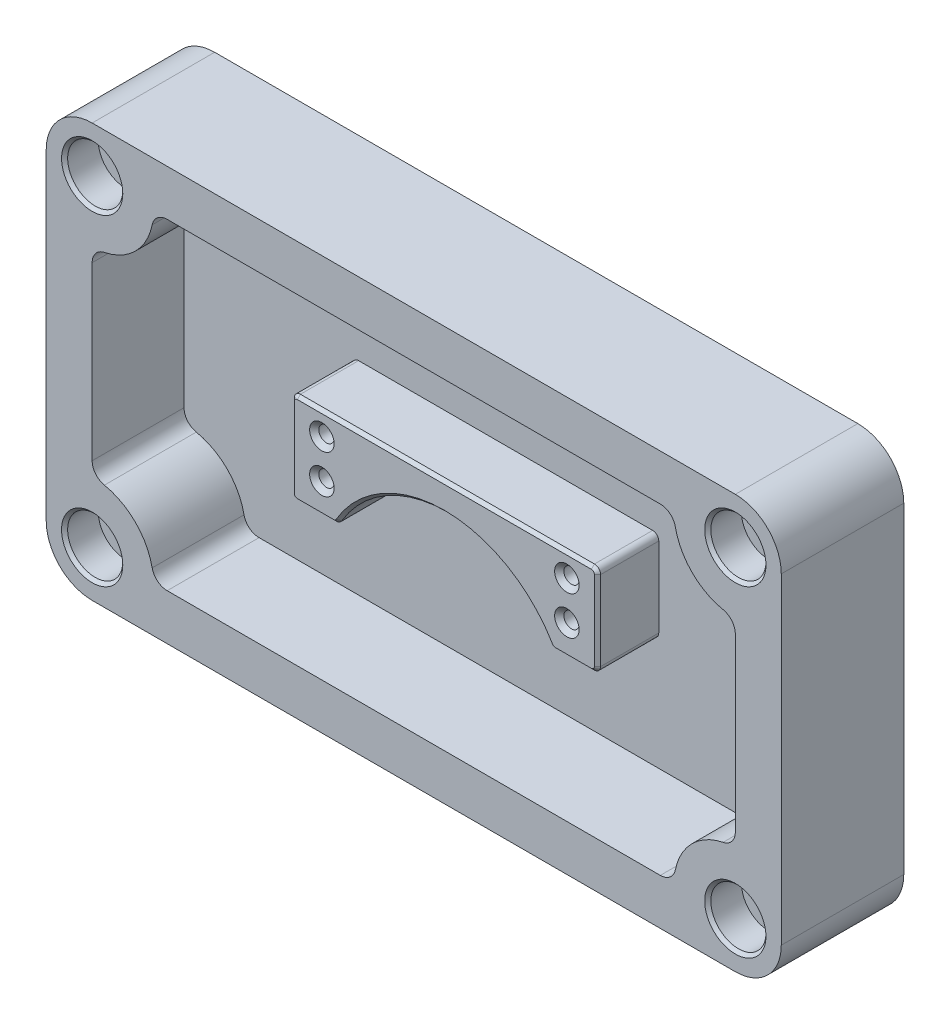
from build123d import *

# Parameters (mm, degrees)
SKETCH_1_R                   = 5.5
EXTRUDE_1_DEPTH              = 40
EXTRUDE_2_DEPTH              = 10
EXTRUDE_3_DEPTH              = 20
HOLE_WIZARD_M6_3_D           = 5
HOLE_WIZARD_M6_3_DEPTH       = 15
HOLE_WIZARD_M6_3_CSINK_D     = 8
HOLE_WIZARD_M6_3_CSINK_ANGLE = 90
HOLE_WIZARD_M6_3_TIP         = 1.502151548
SKETCH_9_R                   = 9
CUT_EXTRUDE_1_DEPTH          = 11
CHAMFER_2_SIZE               = 1
CHAMFER_3_SIZE               = 1


with BuildPart() as part:
    # 草图1 → 凸台-拉伸1 (new body)
    with BuildSketch(Plane.XY):
        with BuildLine():
            Line((0, 15), (0, 120))
            ThreePointArc((0, 120), (4.393398282, 130.606601718), (15, 135))
            Line((15, 135), (225, 135))
            ThreePointArc((225, 135), (235.606601718, 130.606601718), (240, 120))
            Line((240, 120), (240, 15))
            ThreePointArc((240, 15), (235.606601718, 4.393398282), (225, 0))
            Line((225, 0), (15, 0))
            ThreePointArc((15, 0), (4.393398282, 4.393398282), (0, 15))
        make_face()
        with Locations((225, 120)):
            Circle(SKETCH_1_R, mode=Mode.SUBTRACT)
        with Locations(Location((225, 15, 0), (0, 0, 180))):
            Circle(SKETCH_1_R, mode=Mode.SUBTRACT)
        with Locations((15, 15)):
            Circle(SKETCH_1_R, mode=Mode.SUBTRACT)
        with Locations(Location((15, 120, 0), (0, 0, 180))):
            Circle(SKETCH_1_R, mode=Mode.SUBTRACT)
        with BuildLine():
            Line((15, 39.494897428), (15, 95.505102572))
            ThreePointArc((15, 95.505102572), (16.127016654, 98.667380232), (19, 100.404082058))
            ThreePointArc((19, 100.404082058), (29.142135624, 105.857864376), (34.595917942, 116))
            ThreePointArc((34.595917942, 116), (36.332619768, 118.872983346), (39.494897428, 120))
            Line((39.494897428, 120), (200.505102572, 120))
            ThreePointArc((200.505102572, 120), (203.667380232, 118.872983346), (205.404082058, 116))
            ThreePointArc((205.404082058, 116), (210.857864376, 105.857864376), (221, 100.404082058))
            ThreePointArc((221, 100.404082058), (223.872983346, 98.667380232), (225, 95.505102572))
            Line((225, 95.505102572), (225, 39.494897428))
            ThreePointArc((225, 39.494897428), (223.872983346, 36.332619768), (221, 34.595917942))
            ThreePointArc((221, 34.595917942), (210.857864376, 29.142135624), (205.404082058, 19))
            ThreePointArc((205.404082058, 19), (203.667380232, 16.127016654), (200.505102572, 15))
            Line((200.505102572, 15), (39.494897428, 15))
            ThreePointArc((39.494897428, 15), (36.332619768, 16.127016654), (34.595917942, 19))
            ThreePointArc((34.595917942, 19), (29.142135624, 29.142135624), (19, 34.595917942))
            ThreePointArc((19, 34.595917942), (16.127016654, 36.332619768), (15, 39.494897428))
        make_face(mode=Mode.SUBTRACT)
    extrude(amount=EXTRUDE_1_DEPTH)

    # 草图2 → 凸台-拉伸2 (add)
    with BuildSketch(Plane(origin=(0, 0, 0), x_dir=(-1, 0, 0), z_dir=(0, 0, -1))):
        with BuildLine():
            Line((-225, 135), (-15, 135))
            ThreePointArc((-15, 135), (-4.393398282, 130.606601718), (0, 120))
            Line((0, 120), (0, 15))
            ThreePointArc((0, 15), (-4.393398282, 4.393398282), (-15, 0))
            Line((-15, 0), (-225, 0))
            ThreePointArc((-225, 0), (-235.606601718, 4.393398282), (-240, 15))
            Line((-240, 15), (-240, 120))
            ThreePointArc((-240, 120), (-235.606601718, 130.606601718), (-225, 135))
        make_face()
    extrude(amount=-EXTRUDE_2_DEPTH)

    # 草图3 → 凸台-拉伸3 (add)
    with BuildSketch(Plane.XY.offset(10)):
        with BuildLine():
            Line((72, 81.293943495), (168, 81.293943495))
            ThreePointArc((168, 81.293943495), (169.414213562, 80.708157058), (170, 79.293943495))
            Line((170, 79.293943495), (170, 53.293943495))
            ThreePointArc((170, 53.293943495), (169.414213562, 51.879729933), (168, 51.293943495))
            Line((168, 51.293943495), (156.201767504, 51.293943495))
            ThreePointArc((156.201767504, 51.293943495), (155.208790822, 51.557856715), (154.477873813, 52.279946186))
            ThreePointArc((154.477873813, 52.279946186), (120, 72), (85.522126187, 52.279946186))
            ThreePointArc((85.522126187, 52.279946186), (84.791209178, 51.557856715), (83.798232496, 51.293943495))
            Line((83.798232496, 51.293943495), (72, 51.293943495))
            ThreePointArc((72, 51.293943495), (70.585786438, 51.879729933), (70, 53.293943495))
            Line((70, 53.293943495), (70, 79.293943495))
            ThreePointArc((70, 79.293943495), (70.585786438, 80.708157058), (72, 81.293943495))
        make_face()
    extrude(amount=EXTRUDE_3_DEPTH)

    # M6 螺纹孔3
    with Locations(Plane(origin=(80, 73.793943495, 30), x_dir=(1, 0, 0), z_dir=(0, 0, 1))):
        with Locations((0, 0), (0, -12.58788699), (80, 0), (80, -12.58788699)):
            CounterSinkHole(HOLE_WIZARD_M6_3_D / 2, HOLE_WIZARD_M6_3_CSINK_D / 2, depth=HOLE_WIZARD_M6_3_DEPTH, counter_sink_angle=HOLE_WIZARD_M6_3_CSINK_ANGLE)
            with Locations((0, 0, -(HOLE_WIZARD_M6_3_DEPTH + HOLE_WIZARD_M6_3_TIP / 2))):  # 118° drill point
                Cone(0, HOLE_WIZARD_M6_3_D / 2, HOLE_WIZARD_M6_3_TIP, mode=Mode.SUBTRACT)

    # 草图9 → 切除-拉伸1 (cut)
    with BuildSketch(Plane.XY.offset(40)):
        with Locations((15, 120)):
            Circle(SKETCH_9_R)
        with Locations((15, 15)):
            Circle(SKETCH_9_R)
        with Locations((225, 120)):
            Circle(SKETCH_9_R)
        with Locations((225, 15)):
            Circle(SKETCH_9_R)
    extrude(amount=-CUT_EXTRUDE_1_DEPTH, mode=Mode.SUBTRACT)

    # 倒角2
    chamfer_2_edges = [part.edges().sort_by_distance(p)[0] for p in [
        (6, 15, 40),
        (216, 120, 40),
        (216, 15, 40),
        (6, 120, 40),
    ]]
    chamfer(chamfer_2_edges, length=CHAMFER_2_SIZE)

    # 倒角3
    chamfer_3_edges = [part.edges().sort_by_distance(p)[0] for p in [
        (70.585786438, 51.879729933, 30),
        (155.208790822, 51.557856715, 30),
        (162.100883752, 51.293943495, 30),
        (169.414213562, 51.879729933, 30),
        (170, 66.293943495, 30),
        (169.414213562, 80.708157058, 30),
        (120, 81.293943495, 30),
        (70.585786438, 80.708157058, 30),
        (70, 66.293943495, 30),
        (77.899116248, 51.293943495, 30),
        (84.791209178, 51.557856715, 30),
        (120, 72, 30),
    ]]
    chamfer(chamfer_3_edges, length=CHAMFER_3_SIZE)


solid = part.part
